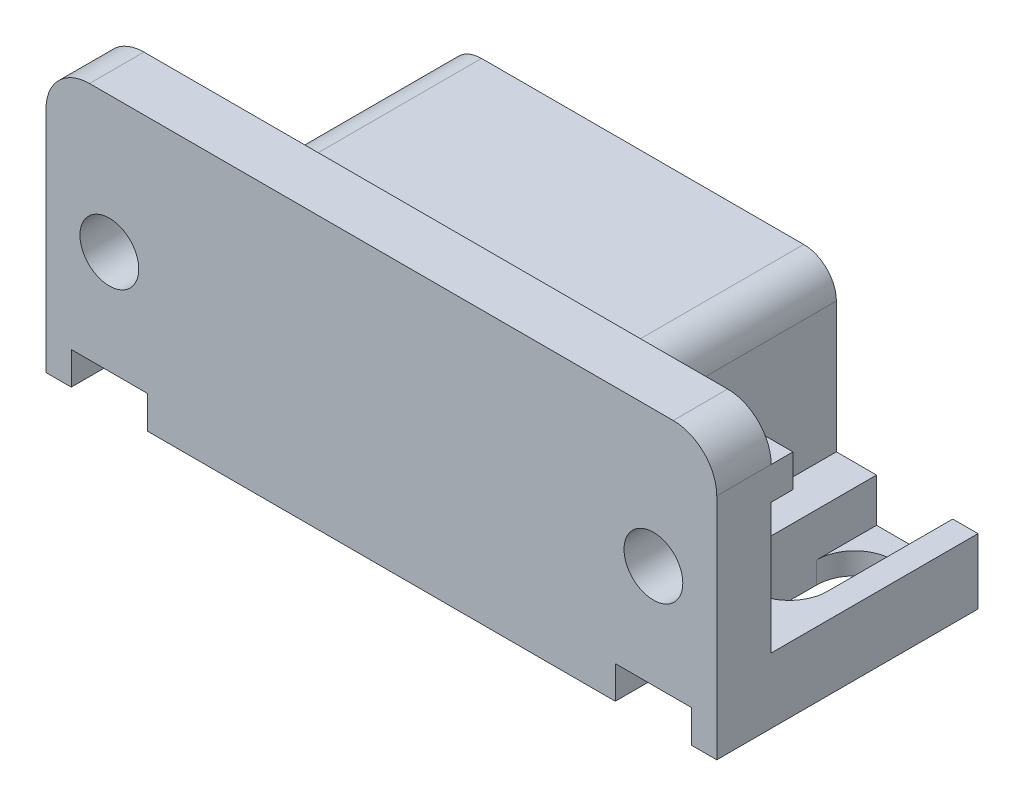
from build123d import *

# Parameters (mm, degrees)
RESSALTO_EXTRUS_O1_DEPTH = 2.5
ESBO_O2_W                = 30.81
ESBO_O2_H                = 3
RESSALTO_EXTRUS_O2_DEPTH = 9.5
ESBO_O3_W                = 17.8
ESBO_O3_H                = 1
CORTE_EXTRUS_O1_DEPTH    = 10
ESBO_O4_W                = 30.81
ESBO_O4_H                = 1.5
RESSALTO_EXTRUS_O3_DEPTH = 1
ESBO_O5_W                = 17.8
ESBO_O5_H                = 9.5
RESSALTO_EXTRUS_O4_DEPTH = 9.5
FILETE1_R                = 1.5
CORTE_EXTRUS_O2_DEPTH    = 22.715524976
ESBO_O7_W                = 3.5
ESBO_O7_H                = 4.25
CORTE_EXTRUS_O3_DEPTH    = 2
ESBO_O8_W                = 3.5
ESBO_O8_H                = 6.727306506
CORTE_EXTRUS_O4_DEPTH    = 1.5
ESBO_O9_R                = 1.35
CORTE_EXTRUS_O5_DEPTH    = 21.503085743
ESBO_O10_W               = 0.8
ESBO_O10_H               = 2
CORTE_EXTRUS_O6_DEPTH    = 2.5
PADR_O_LINEAR1_COUNT     = 3
PADR_O_LINEAR1_PITCH     = 2.77
PADR_O_LINEAR1_COL_COUNT = 3
PADR_O_LINEAR1_COL_PITCH = 2.77
ESBO_O11_W               = 0.8
ESBO_O11_H               = 4.7
CORTE_EXTRUS_O7_DEPTH    = 1
ESBO_O12_W               = 0.8
ESBO_O12_H               = 1.5
CORTE_EXTRUS_O8_DEPTH    = 2
PADR_O_LINEAR2_COUNT     = 4
PADR_O_LINEAR2_PITCH     = 2.77


with BuildPart() as part:
    # Esboço1 → Ressalto-extrusão1 (new body)
    with BuildSketch(Plane.XY):
        with BuildLine():
            Line((-13.405, 6.25), (13.405, 6.25))
            ThreePointArc((13.405, 6.25), (14.819213562, 5.664213562), (15.405, 4.25))
            Line((15.405, 4.25), (15.405, -6.25))
            Line((15.405, -6.25), (-15.405, -6.25))
            Line((-15.405, -6.25), (-15.405, 4.25))
            ThreePointArc((-15.405, 4.25), (-14.819213562, 5.664213562), (-13.405, 6.25))
        make_face()
    extrude(amount=-RESSALTO_EXTRUS_O1_DEPTH)

    # Esboço2 → Ressalto-extrusão2 (add)
    with BuildSketch(Plane(origin=(0, 0, -2.5), x_dir=(-1, 0, 0), z_dir=(0, 0, -1))):
        with Locations((0, -4.75)):
            Rectangle(ESBO_O2_W, ESBO_O2_H)
    extrude(amount=RESSALTO_EXTRUS_O2_DEPTH)

    # Esboço3 → Corte-extrusão1 (cut)
    with BuildSketch(Plane(origin=(0, 0, -12), x_dir=(-1, 0, 0), z_dir=(0, 0, -1))):
        with Locations((0, -5.75)):
            Rectangle(ESBO_O3_W, ESBO_O3_H)
    extrude(amount=-CORTE_EXTRUS_O1_DEPTH, mode=Mode.SUBTRACT)

    # Esboço4 → Ressalto-extrusão3 (add)
    with BuildSketch(Plane(origin=(0, 0, -2.5), x_dir=(-1, 0, 0), z_dir=(0, 0, -1))):
        with Locations((0, 3.5)):
            Rectangle(ESBO_O4_W, ESBO_O4_H)
    extrude(amount=RESSALTO_EXTRUS_O3_DEPTH)

    # Esboço5 → Ressalto-extrusão4 (add)
    with BuildSketch(Plane(origin=(0, 0, -2.5), x_dir=(-1, 0, 0), z_dir=(0, 0, -1))):
        with Locations((0, -0.5)):
            Rectangle(ESBO_O5_W, ESBO_O5_H)
    extrude(amount=RESSALTO_EXTRUS_O4_DEPTH)

    # Filete1
    filete1_edges = [part.edges().sort_by_distance(p)[0] for p in [
        (8.9, 4.25, -7.75),
        (-8.9, 4.25, -7.75),
    ]]
    fillet(filete1_edges, radius=FILETE1_R)

    # Esboço6 → Corte-extrusão2 (cut, through all)
    with BuildSketch(Plane(origin=(0, -3.25, 0), x_dir=(1, 0, 0), z_dir=(0, 1, 0))):
        with BuildLine():
            Line((10.745, 6.25), (10.745, 9.25))
            ThreePointArc((10.745, 9.25), (12.495, 11), (14.245, 9.25))
            Line((14.245, 9.25), (14.245, 6.25))
            ThreePointArc((14.245, 6.25), (12.495, 4.5), (10.745, 6.25))
        make_face()
    corte_extrus_o2 = extrude(amount=-CORTE_EXTRUS_O2_DEPTH, mode=Mode.SUBTRACT)

    # Espelhar1: Corte-extrusão2 across plane
    add(corte_extrus_o2.mirror(Plane(origin=(0, 0, 0), x_dir=(0, 0, 1), z_dir=(1, 0, 0))), mode=Mode.SUBTRACT)

    # Esboço7 → Corte-extrusão3 (cut)
    with BuildSketch(Plane(origin=(0, -3.25, 0), x_dir=(1, 0, 0), z_dir=(0, 1, 0))):
        with Locations((12.495, 9.875)):
            Rectangle(ESBO_O7_W, ESBO_O7_H)
    corte_extrus_o3 = extrude(amount=-CORTE_EXTRUS_O3_DEPTH, mode=Mode.SUBTRACT)

    # Espelhar2: Corte-extrusão3 across plane
    add(corte_extrus_o3.mirror(Plane(origin=(0, 0, 0), x_dir=(0, 0, 1), z_dir=(1, 0, 0))), mode=Mode.SUBTRACT)

    # Esboço8 → Corte-extrusão4 (cut)
    with BuildSketch(Plane.XZ.offset(6.25)):
        with Locations((-12.495, -3.363653253)):
            Rectangle(ESBO_O8_W, ESBO_O8_H)
    corte_extrus_o4 = extrude(amount=-CORTE_EXTRUS_O4_DEPTH, mode=Mode.SUBTRACT)

    # Espelhar3: Corte-extrusão3, Corte-extrusão4 across plane
    add(corte_extrus_o3.mirror(Plane(origin=(0, 0, 0), x_dir=(0, 0, 1), z_dir=(1, 0, 0))), mode=Mode.SUBTRACT)
    add(corte_extrus_o4.mirror(Plane(origin=(0, 0, 0), x_dir=(0, 0, 1), z_dir=(1, 0, 0))), mode=Mode.SUBTRACT)

    # Esboço9 → Corte-extrusão5 (cut, through all)
    with BuildSketch(Plane.XY):
        with Locations((12.495, 0)):
            Circle(ESBO_O9_R)
    corte_extrus_o5 = extrude(amount=-CORTE_EXTRUS_O5_DEPTH, mode=Mode.SUBTRACT)

    # Espelhar4: Corte-extrusão5 across plane
    add(corte_extrus_o5.mirror(Plane(origin=(0, 0, 0), x_dir=(0, 0, 1), z_dir=(1, 0, 0))), mode=Mode.SUBTRACT)

    # Esboço10 → Corte-extrusão6 (cut)
    with BuildSketch(Plane.XZ.offset(5.25)):
        with Locations((0, -11)):
            Rectangle(ESBO_O10_W, ESBO_O10_H)
    corte_extrus_o6 = extrude(amount=-CORTE_EXTRUS_O6_DEPTH, mode=Mode.SUBTRACT)

    # Padrão linear1: Corte-extrusão6 ×3
    with Locations(*[(-i * PADR_O_LINEAR1_PITCH, 0, 0) for i in range(1, PADR_O_LINEAR1_COUNT)]):
        add(corte_extrus_o6, mode=Mode.SUBTRACT)

    # Padrão linear1 col: Corte-extrusão6 ×3
    with Locations(*[(i * PADR_O_LINEAR1_COL_PITCH, 0, 0) for i in range(1, PADR_O_LINEAR1_COL_COUNT)]):
        add(corte_extrus_o6, mode=Mode.SUBTRACT)

    # Esboço11 → Corte-extrusão7 (cut)
    with BuildSketch(Plane.XZ.offset(5.25)):
        with Locations((4.155, -9.65)):
            Rectangle(ESBO_O11_W, ESBO_O11_H)
    corte_extrus_o7 = extrude(amount=-CORTE_EXTRUS_O7_DEPTH, mode=Mode.SUBTRACT)

    # Esboço12 → Corte-extrusão8 (cut)
    with BuildSketch(Plane(origin=(0, 0, -12), x_dir=(-1, 0, 0), z_dir=(0, 0, -1))):
        with Locations((-4.155, -3.5)):
            Rectangle(ESBO_O12_W, ESBO_O12_H)
    corte_extrus_o8 = extrude(amount=-CORTE_EXTRUS_O8_DEPTH, mode=Mode.SUBTRACT)

    # Padrão linear2: Corte-extrusão7, Corte-extrusão8 ×4
    with Locations(*[(-i * PADR_O_LINEAR2_PITCH, 0, 0) for i in range(1, PADR_O_LINEAR2_COUNT)]):
        add(corte_extrus_o7, mode=Mode.SUBTRACT)
        add(corte_extrus_o8, mode=Mode.SUBTRACT)


solid = part.part
